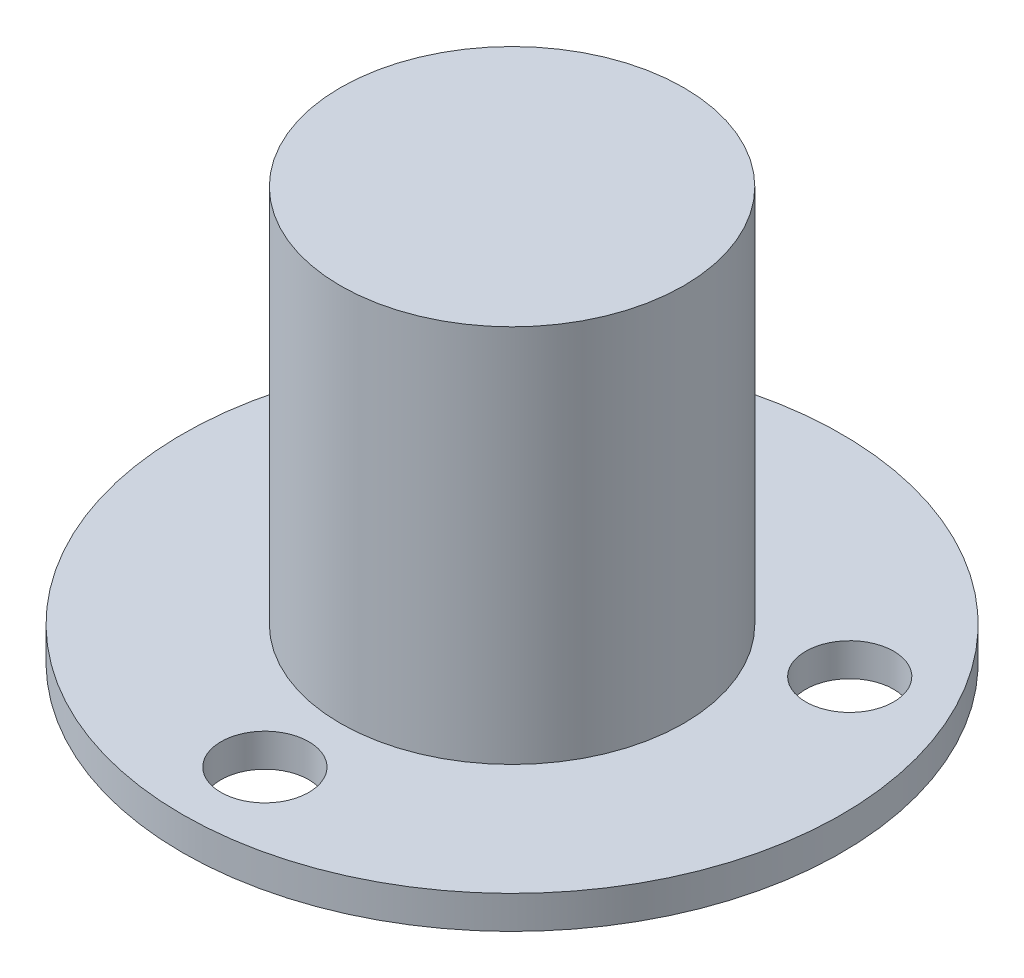
from build123d import *

# Parameters (mm, degrees)
SKETCH1_R           = 12
BOSS_EXTRUDE1_DEPTH = 1.2
SKETCH2_R           = 6.25
BOSS_EXTRUDE2_DEPTH = 13.8
SKETCH3_R           = 2.5
BOSS_EXTRUDE3_DEPTH = 1.5
SKETCH4_R           = 1.6
CUT_EXTRUDE1_DEPTH  = 1.2


with BuildPart() as part:
    # Sketch1 → Boss-Extrude1 (new body)
    with BuildSketch(Plane(origin=(0, 0, 0), x_dir=(1, 0, 0), z_dir=(0, 1, 0))):
        with Locations(Location((0, 0, 0), (0, 0, 270))):
            Circle(SKETCH1_R)
    extrude(amount=BOSS_EXTRUDE1_DEPTH)

    # Sketch2 → Boss-Extrude2 (add)
    with BuildSketch(Plane(origin=(0, 1.2, 0), x_dir=(1, 0, 0), z_dir=(0, 1, 0))):
        with Locations(Location((0, 0, 0), (0, 0, 90))):
            Circle(SKETCH2_R)
    extrude(amount=BOSS_EXTRUDE2_DEPTH)

    # Sketch3 → Boss-Extrude3 (add)
    with BuildSketch(Plane.XZ):
        with Locations(Location((0, 0, 0), (0, 0, 270))):
            Circle(SKETCH3_R)
    extrude(amount=BOSS_EXTRUDE3_DEPTH)

    # Sketch4 → Cut-Extrude1 (cut)
    with BuildSketch(Plane.XZ):
        with Locations(Location((0, 9, 0), (0, 0, 270))):
            Circle(SKETCH4_R)
        with Locations(Location((7.794228634, -4.5, 0), (0, 0, 270))):
            Circle(SKETCH4_R)
        with Locations(Location((-7.794228634, -4.5, 0), (0, 0, 270))):
            Circle(SKETCH4_R)
    extrude(amount=-CUT_EXTRUDE1_DEPTH, mode=Mode.SUBTRACT)


solid = part.part
